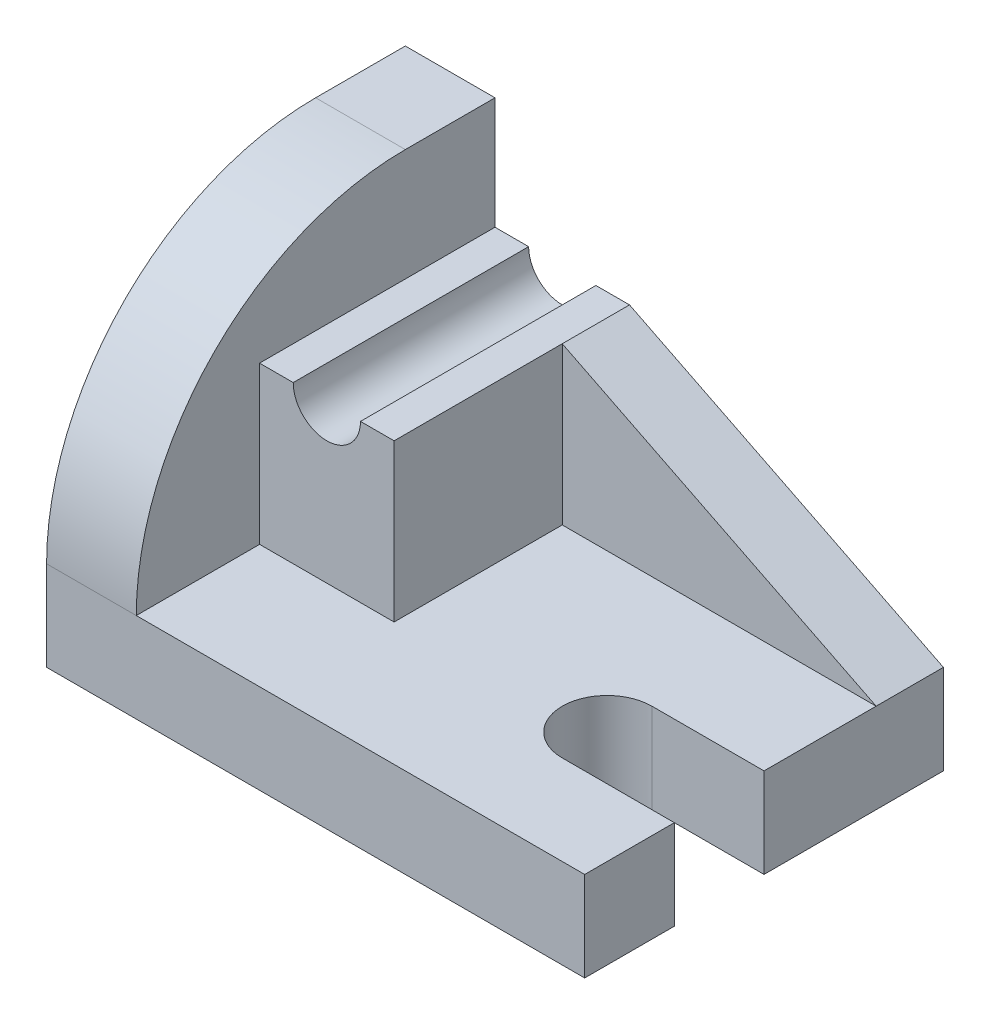
from build123d import *

# Parameters (mm, degrees)
SKETCH2_W           = 96
SKETCH2_H           = 64
BOSS_EXTRUDE1_DEPTH = 16
CUT_EXTRUDE1_DEPTH  = 16
BOSS_EXTRUDE2_DEPTH = 16
SKETCH11_W          = 24
SKETCH11_H          = 42
BOSS_EXTRUDE3_DEPTH = 28
BOSS_EXTRUDE4_DEPTH = 12
CUT_EXTRUDE2_START  = -42
SKETCH16_R          = 6
CUT_EXTRUDE2_DEPTH  = 42


with BuildPart() as part:
    # Sketch2 → Boss-Extrude1 (new body)
    with BuildSketch(Plane(origin=(0, 0, 0), x_dir=(1, 0, 0), z_dir=(0, 1, 0))):
        Rectangle(SKETCH2_W, SKETCH2_H)
    extrude(amount=BOSS_EXTRUDE1_DEPTH)

    # Sketch5 → Cut-Extrude1 (cut)
    with BuildSketch(Plane(origin=(0, 16, 0), x_dir=(1, 0, 0), z_dir=(0, 1, 0))):
        with BuildLine():
            Line((48, -16), (28, -16))
            ThreePointArc((28, -16), (20, -8), (28, 0))
            Line((28, 0), (48, 0))
            ThreePointArc((48, 0), (56, -8), (48, -16))
        make_face()
    extrude(amount=-CUT_EXTRUDE1_DEPTH, mode=Mode.SUBTRACT)

    # Sketch10 → Boss-Extrude2 (add)
    with BuildSketch(Plane.ZY.offset(48)):
        with BuildLine():
            Line((32, 0), (-32, 0))
            Line((-32, 0), (-32, 64))
            Line((-32, 64), (-16, 64))
            ThreePointArc((-16, 64), (17.941125497, 49.941125497), (32, 16))
            Line((32, 16), (32, 0))
        make_face()
    extrude(amount=-BOSS_EXTRUDE2_DEPTH)

    # Sketch11 → Boss-Extrude3 (add)
    with BuildSketch(Plane(origin=(0, 16, 0), x_dir=(1, 0, 0), z_dir=(0, 1, 0))):
        with Locations((-20, 11)):
            Rectangle(SKETCH11_W, SKETCH11_H)
    extrude(amount=BOSS_EXTRUDE3_DEPTH)

    # Sketch15 → Boss-Extrude4 (add)
    with BuildSketch(Plane(origin=(0, 0, -32), x_dir=(-1, 0, 0), z_dir=(0, 0, -1))):
        Polygon((-48, 16), (8, 44), (8, 16), align=None)
    extrude(amount=-BOSS_EXTRUDE4_DEPTH)

    # Sketch16 → Cut-Extrude2 (cut)
    with BuildSketch(Plane(origin=(0, 0, -32), x_dir=(-1, 0, 0), z_dir=(0, 0, -1)).offset(CUT_EXTRUDE2_START)):
        with Locations((20, 44)):
            Circle(SKETCH16_R)
    extrude(amount=CUT_EXTRUDE2_DEPTH, mode=Mode.SUBTRACT)


solid = part.part
